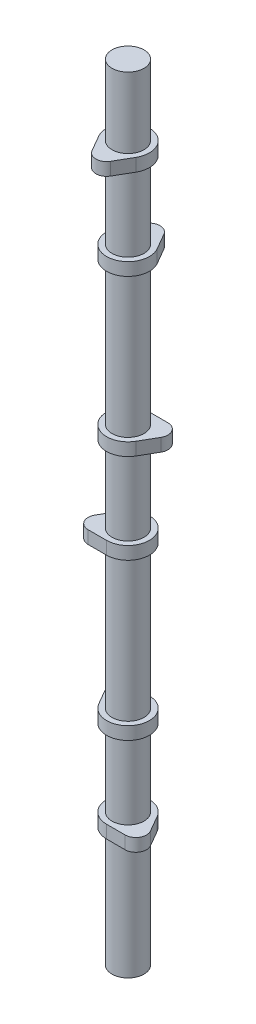
from build123d import *

# Parameters (mm, degrees)
BOSS_EXTRUDE1_DEPTH   = 7.62
LPATTERN1_COUNT       = 2
LPATTERN1_PITCH       = 53.34
BODY_MOVE_COPY1_ANGLE = 180
LPATTERN2_COUNT       = 3
LPATTERN2_PITCH       = 146.05
BODY_MOVE_COPY3_ANGLE = 120
BODY_MOVE_COPY4_ANGLE = 120
BOSS_EXTRUDE2_START   = 102.87
SKETCH2_R             = 9.5
BOSS_EXTRUDE2_DEPTH   = 466.09


with BuildPart() as part:
    # Sketch1 → Boss-Extrude1 (new body)
    with BuildSketch(Plane(origin=(0, 0, 0), x_dir=(1, 0, 0), z_dir=(0, 1, 0))):
        with BuildLine():
            Line((-10.998522628, 6.35), (-5.499261314, 15.875))
            ThreePointArc((-5.499261314, 15.875), (0, 19.05), (5.499261314, 15.875))
            Line((5.499261314, 15.875), (10.998522628, 6.35))
            ThreePointArc((10.998522628, 6.35), (0, -12.7), (-10.998522628, 6.35))
        make_face()
    extrude(amount=BOSS_EXTRUDE1_DEPTH)


with BuildPart() as lpattern1_1:
    # LPattern1: pattern copy
    add(part.part.moved(Location(Vector(0, 1, 0) * (1 * LPATTERN1_PITCH))))


with BuildPart() as lpattern1_1_1:
    # Body-Move/Copy1: moved
    add(lpattern1_1.part.rotate(Axis((0, 0, 0), (0, 1, 0)), BODY_MOVE_COPY1_ANGLE))


with BuildPart() as lpattern2_1:
    # LPattern2: pattern copy
    add(lpattern1_1_1.part.moved(Location(Vector(0, -1, 0) * (1 * LPATTERN2_PITCH))))


with BuildPart() as lpattern2_2:
    # LPattern2: pattern copy
    add(lpattern1_1_1.part.moved(Location(Vector(0, -1, 0) * (2 * LPATTERN2_PITCH))))


with BuildPart() as lpattern2_3:
    # LPattern2: pattern copy
    add(part.part.moved(Location(Vector(0, -1, 0) * (1 * LPATTERN2_PITCH))))


with BuildPart() as lpattern2_4:
    # LPattern2: pattern copy
    add(part.part.moved(Location(Vector(0, -1, 0) * (2 * LPATTERN2_PITCH))))


with BuildPart() as lpattern2_3_1:
    # Body-Move/Copy3: moved
    add(lpattern2_3.part.rotate(Axis((0, 0, 0), (0, 1, 0)), BODY_MOVE_COPY3_ANGLE))


with BuildPart() as lpattern2_1_1:
    # Body-Move/Copy3: moved
    add(lpattern2_1.part.rotate(Axis((0, 0, 0), (0, 1, 0)), BODY_MOVE_COPY3_ANGLE))


with BuildPart() as lpattern2_4_1:
    # Body-Move/Copy4: moved
    add(lpattern2_4.part.rotate(Axis((0, 0, 0), (0, -1, 0)), BODY_MOVE_COPY4_ANGLE))


with BuildPart() as lpattern2_2_1:
    # Body-Move/Copy4: moved
    add(lpattern2_2.part.rotate(Axis((0, 0, 0), (0, -1, 0)), BODY_MOVE_COPY4_ANGLE))


with BuildPart() as part_1:
    add(part.part)

    add(lpattern1_1_1.part)  # Boss-Extrude2 merges LPattern1_1

    add(lpattern2_1_1.part)  # Boss-Extrude2 merges LPattern2_1

    add(lpattern2_2_1.part)  # Boss-Extrude2 merges LPattern2_2

    add(lpattern2_3_1.part)  # Boss-Extrude2 merges LPattern2_3

    add(lpattern2_4_1.part)  # Boss-Extrude2 merges LPattern2_4
    # Sketch2 → Boss-Extrude2 (add)
    with BuildSketch(Plane(origin=(0, 0, 0), x_dir=(1, 0, 0), z_dir=(0, 1, 0)).offset(BOSS_EXTRUDE2_START)):
        Circle(SKETCH2_R)
    extrude(amount=-BOSS_EXTRUDE2_DEPTH)


solid = part_1.part
